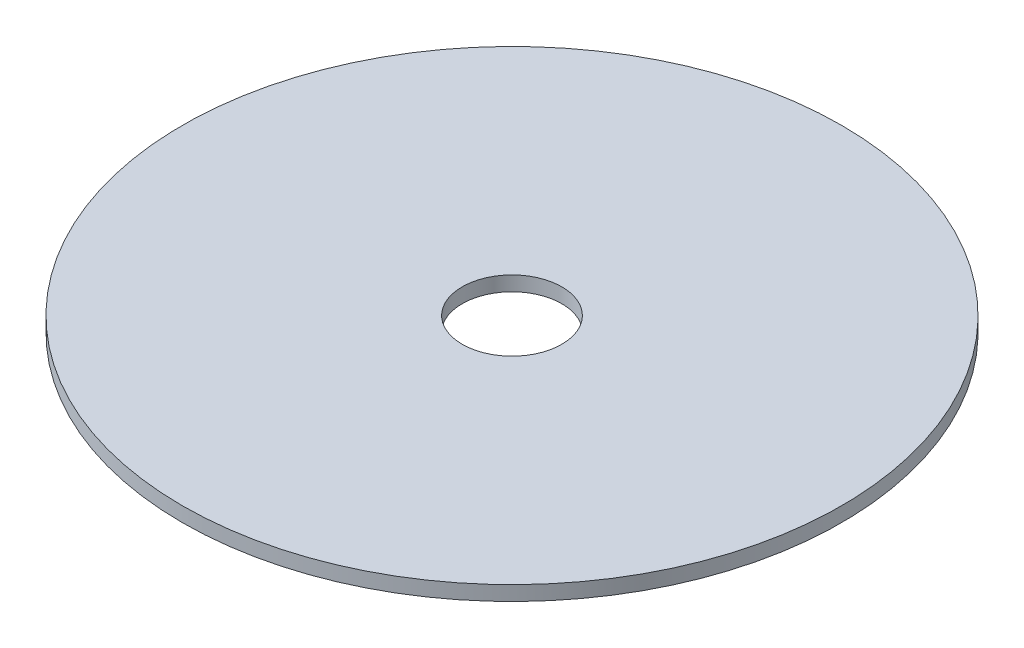
from build123d import *

# Parameters (mm, degrees)
CROQUIS1_R              = 22.5
CROQUIS1_R_2            = 3.4
SALIENTE_EXTRUIR1_DEPTH = 1


with BuildPart() as part:
    # Croquis1 → Saliente-Extruir1 (new body)
    with BuildSketch(Plane(origin=(0, 0, 0), x_dir=(1, 0, 0), z_dir=(0, 1, 0))):
        with Locations(Location((0, 0, 0), (0, 0, 270))):
            Circle(CROQUIS1_R)
        with Locations(Location((0, 0, 0), (0, 0, 270))):
            Circle(CROQUIS1_R_2, mode=Mode.SUBTRACT)
    extrude(amount=SALIENTE_EXTRUIR1_DEPTH)


solid = part.part
